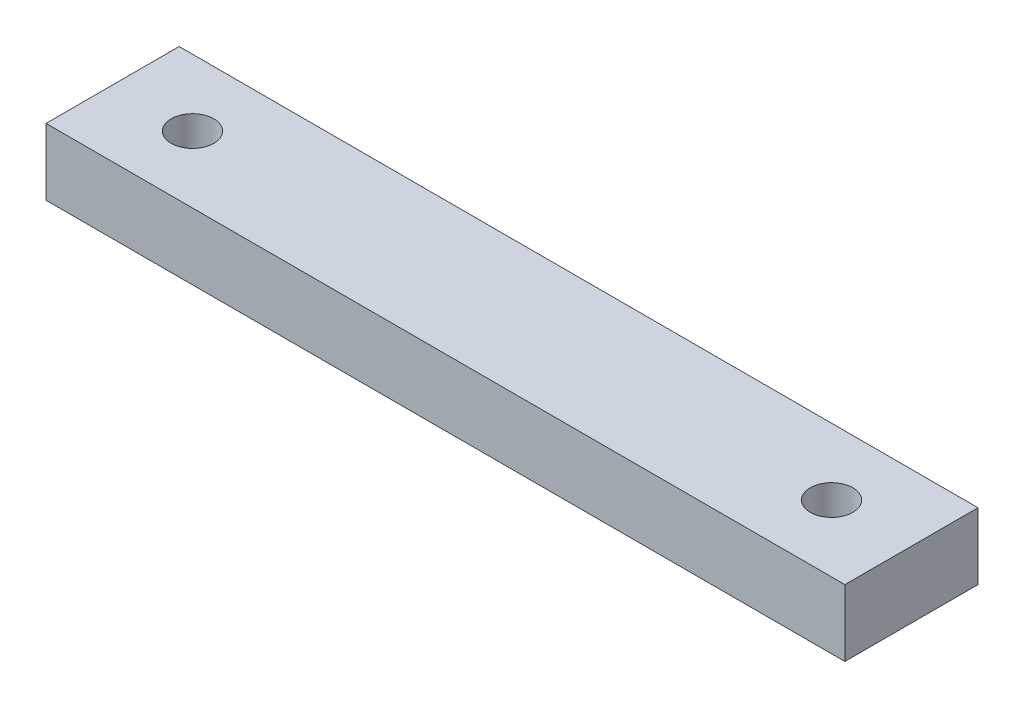
from build123d import *

# Parameters (mm, degrees)
SKETCH_1_W      = 60
SKETCH_1_H      = 10
SKETCH_1_R      = 1.6
EXTRUDE_1_DEPTH = 5


with BuildPart() as part:
    # 草图1 → 凸台-拉伸1 (new body)
    with BuildSketch(Plane(origin=(0, 0, 0), x_dir=(1, 0, 0), z_dir=(0, 1, 0))):
        Rectangle(SKETCH_1_W, SKETCH_1_H)
        with Locations(Location((-24, 0, 0), (0, 0, 270))):
            Circle(SKETCH_1_R, mode=Mode.SUBTRACT)
        with Locations(Location((24, 0, 0), (0, 0, 90))):
            Circle(SKETCH_1_R, mode=Mode.SUBTRACT)
    extrude(amount=EXTRUDE_1_DEPTH)


solid = part.part
